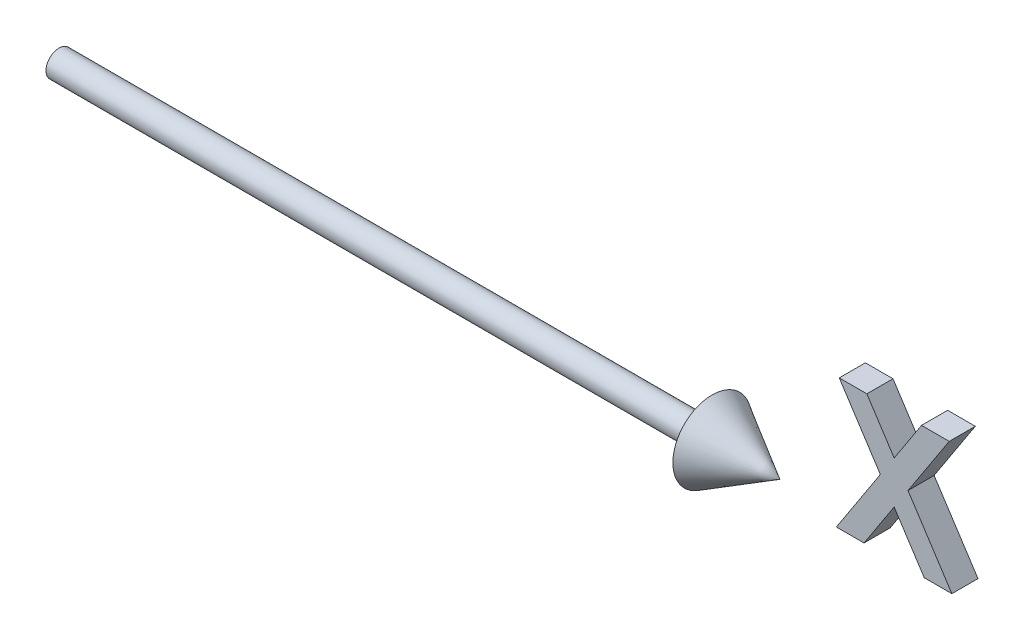
from build123d import *

# Parameters (mm, degrees)
SKETCH1_R           = 1
BOSS_EXTRUDE1_DEPTH = 50
BOSS_EXTRUDE2_DEPTH = 1


with BuildPart() as part:
    # Sketch1 → Boss-Extrude1 (new body)
    with BuildSketch(Plane(origin=(0, 0, 0), x_dir=(0, 0, -1), z_dir=(1, 0, 0))):
        Circle(SKETCH1_R)
    extrude(amount=BOSS_EXTRUDE1_DEPTH)


with BuildPart() as body_2:
    # Sketch4 → Revolve1 (revolve)
    with BuildSketch(Plane(origin=(0, 0, 0), x_dir=(1, 0, 0), z_dir=(0, 1, 0)), mode=Mode.PRIVATE) as revolve1_sk:
        Polygon((50, 0), (50, 3), (55.196152423, 0), align=None)
    revolve(revolve1_sk.sketch.rotate(Axis((50, 0, 0), (1, 0, 0)), 180), axis=Axis((50, 0, 0), (1, 0, 0)))


with BuildPart() as body_3:
    # Sketch5 → Boss-Extrude2 (new, symmetric)
    with BuildSketch(Plane.XY):
        Polygon((60.739021012, 10), (62.854405628, 10), (64.943748577, 6.788862179), (67.037097936, 10), (69.158492166, 10), (66.003444089, 5.162259615), (69.362819089, 0), (67.247434474, 0), (64.943748577, 3.539663462), (62.636056269, 0), (60.516665243, 0), (63.886056269, 5.166266026), align=None)
    extrude(amount=BOSS_EXTRUDE2_DEPTH, both=True)


solid = Compound([part.part, body_2.part, body_3.part])
